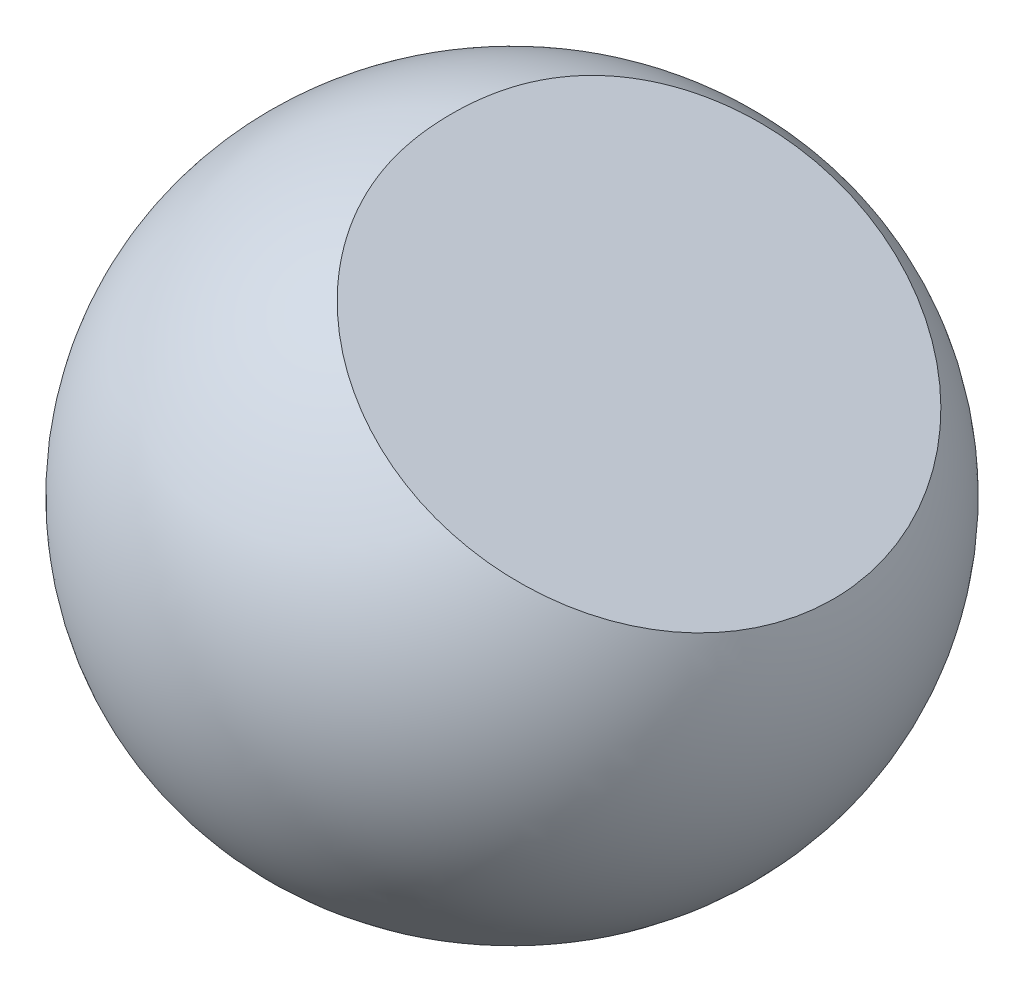
from build123d import *

# Parameters (mm, degrees)
CUT_EXTRUDE1_DEPTH      = 86.356590332
CUT_EXTRUDE1_DEPTH_BACK = 86.356590332


with BuildPart() as part:
    # Sketch1 → Revolve1 (revolve)
    with BuildSketch(Plane.XY):
        with BuildLine():
            Line((0, 49.509049853), (0, -35))
            Line((0, -35), (-25.272030651, -35))
            ThreePointArc((-25.272030651, -35), (-47.186298393, 17.586623254), (0, 49.509049853))
        make_face()
    revolve(axis=Axis((0, 0, 0), (0, 1, 0)))

    # Sketch2 → Cut-Extrude1 (cut, two sides: drawn at the far end of the back side and taken through both)
    with BuildSketch(Plane.XY.offset(-CUT_EXTRUDE1_DEPTH_BACK)):
        Polygon((-10, 50), (48.300943389, 15), (48.300943389, 50), align=None)
    extrude(amount=CUT_EXTRUDE1_DEPTH + CUT_EXTRUDE1_DEPTH_BACK, mode=Mode.SUBTRACT)


solid = part.part
